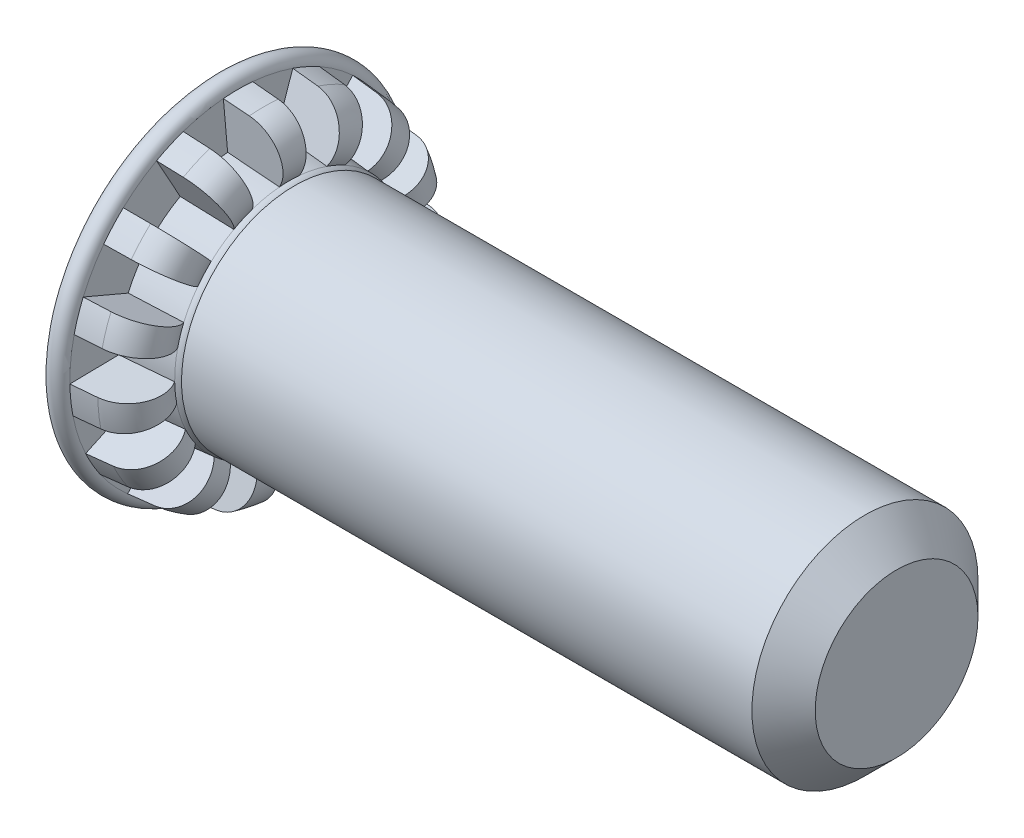
from build123d import *

# Parameters (mm, degrees)
BOSS_EXTRUDE1_START = 6
SKETCH2_R           = 2
BOSS_EXTRUDE1_DEPTH = 12
REVOLVE2_ANGLE      = 10
CIRPATTERN1_COUNT   = 15
CHAMFER1_SIZE       = 0.56


with BuildPart() as part:
    # Sketch2 → Boss-Extrude1 (new body)
    with BuildSketch(Plane(origin=(0, 0, 0), x_dir=(0, 0, -1), z_dir=(1, 0, 0)).offset(BOSS_EXTRUDE1_START)):
        Circle(SKETCH2_R)
    extrude(amount=-BOSS_EXTRUDE1_DEPTH)

    # Sketch5 → Revolve1 (revolve)
    with BuildSketch(Plane.XY, mode=Mode.PRIVATE) as revolve1_sk:
        with BuildLine():
            Line((-6, 0), (-6, 2.975))
            ThreePointArc((-6, 2.975), (-5.825, 3.15), (-5.65, 2.975))
            Line((-5.65, 2.975), (-5.65, 2.110172817))
            Line((-5.65, 2.110172817), (-4.740028773, 2.03056065))
            ThreePointArc((-4.740028773, 2.03056065), (-4.65, 2), (-4.584254841, 1.931321711))
            Line((-4.584254841, 1.931321711), (-3.469205731, 0))
            Line((-3.469205731, 0), (-6, 0))
        make_face()
    revolve(revolve1_sk.sketch.rotate(Axis((-6, 0, 0), (1, 0, 0)), 180), axis=Axis((-6, 0, 0), (1, 0, 0)))

    # Sketch6 → Revolve2 (revolve, symmetric)
    with BuildSketch(Plane.XY) as revolve2_sk:
        with BuildLine():
            Line((-5.65, 2.975), (-5.65, 0))
            Line((-5.65, 0), (-4.740028773, 0))
            Line((-4.740028773, 0), (-4.740028773, 2.03056065))
            ThreePointArc((-4.740028773, 2.03056065), (-4.715248765, 2.609757983), (-5.195014387, 2.935193917))
            Line((-5.195014387, 2.935193917), (-5.65, 2.975))
        make_face()
    revolve(axis=Axis((-5.65, 0, 0), (1, 0, 0)), revolution_arc=REVOLVE2_ANGLE / 2)
    revolve(revolve2_sk.sketch, axis=Axis((-5.65, 0, 0), (-1, 0, 0)), revolution_arc=REVOLVE2_ANGLE / 2)

    # CirPattern1: part ×15 about axis
    cirpattern1_axis = Axis((0, 0, 0), (1, 0, 0))


with BuildPart() as part_1:
    add(part.part)
    for i in range(1, CIRPATTERN1_COUNT):
        add(part.part.rotate(cirpattern1_axis, i * 360 / CIRPATTERN1_COUNT))

    # Chamfer1
    chamfer1_edges = [part_1.edges().sort_by_distance(p)[0] for p in [
        (6, 0, 2),
    ]]
    chamfer(chamfer1_edges, length=CHAMFER1_SIZE)


solid = part_1.part
